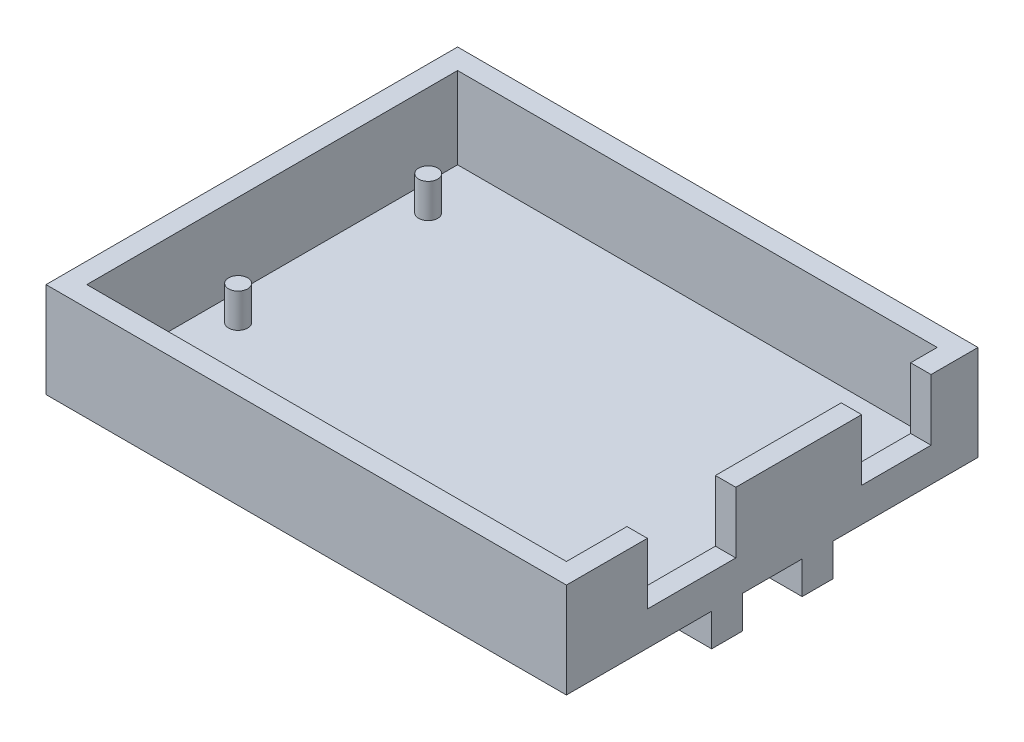
from build123d import *

# Parameters (mm, degrees)
SKETCH1_W           = 76.5
SKETCH1_H           = 60.5
BOSS_EXTRUDE1_DEPTH = 14
SKETCH2_W           = 70.5
SKETCH2_H           = 54.5
CUT_EXTRUDE1_DEPTH  = 12
CUT_EXTRUDE2_REACH  = 85.446
SKETCH4_W           = 13
SKETCH4_H           = 9
SKETCH4_W_2         = 10.2
SKETCH5_W           = 76.5
SKETCH5_H           = 4.5
BOSS_EXTRUDE3_DEPTH = 4.8
SKETCH6_R           = 1.4
BOSS_EXTRUDE4_DEPTH = 5


with BuildPart() as part:
    # Sketch1 → Boss-Extrude1 (new body)
    with BuildSketch(Plane(origin=(0, 0, 0), x_dir=(1, 0, 0), z_dir=(0, 1, 0))):
        Rectangle(SKETCH1_W, SKETCH1_H)
    extrude(amount=BOSS_EXTRUDE1_DEPTH)

    # Sketch2 → Cut-Extrude1 (cut)
    with BuildSketch(Plane(origin=(0, 14, 0), x_dir=(1, 0, 0), z_dir=(0, 1, 0))):
        Rectangle(SKETCH2_W, SKETCH2_H)
    extrude(amount=-CUT_EXTRUDE1_DEPTH, mode=Mode.SUBTRACT)

    # Sketch4 → Cut-Extrude2 (cut, up to next)
    with BuildSketch(Plane(origin=(38.25, 0, 0), x_dir=(0, 0, -1), z_dir=(1, 0, 0)), mode=Mode.PRIVATE) as cut_extrude2_sk1:
        with Locations((-11.85, 9.5)):
            Rectangle(SKETCH4_W, SKETCH4_H)
    cut_extrude2_tool1 = extrude(cut_extrude2_sk1.sketch, amount=-CUT_EXTRUDE2_REACH, mode=Mode.PRIVATE) & part.part
    # Sketch4 → Cut-Extrude2 (cut, up to next)
    with BuildSketch(Plane(origin=(38.25, 0, 0), x_dir=(0, 0, -1), z_dir=(1, 0, 0)), mode=Mode.PRIVATE) as cut_extrude2_sk2:
        with Locations((18.25, 9.5)):
            Rectangle(SKETCH4_W_2, SKETCH4_H)
    cut_extrude2_tool2 = extrude(cut_extrude2_sk2.sketch, amount=-CUT_EXTRUDE2_REACH, mode=Mode.PRIVATE) & part.part
    add(cut_extrude2_tool1.solids().sort_by_distance((38.25, 9.5, 11.85))[0], mode=Mode.SUBTRACT)
    add(cut_extrude2_tool2.solids().sort_by_distance((38.25, 9.5, -18.25))[0], mode=Mode.SUBTRACT)

    # Sketch5 → Boss-Extrude3 (add)
    with BuildSketch(Plane.XZ):
        with Locations((0, 6.65)):
            Rectangle(SKETCH5_W, SKETCH5_H)
    boss_extrude3 = extrude(amount=BOSS_EXTRUDE3_DEPTH)

    # Mirror1: Boss-Extrude3 across plane
    add(boss_extrude3.mirror(Plane.XY))

    # Sketch6 → Boss-Extrude4 (add)
    with BuildSketch(Plane(origin=(0, 2, 0), x_dir=(1, 0, 0), z_dir=(0, 1, 0))):
        with Locations(Location((-31.29, -8.97, 0), (0, 0, 270))):
            Circle(SKETCH6_R)
        with Locations(Location((-31.29, 18.97, 0), (0, 0, 270))):
            Circle(SKETCH6_R)
    extrude(amount=BOSS_EXTRUDE4_DEPTH)


solid = part.part
